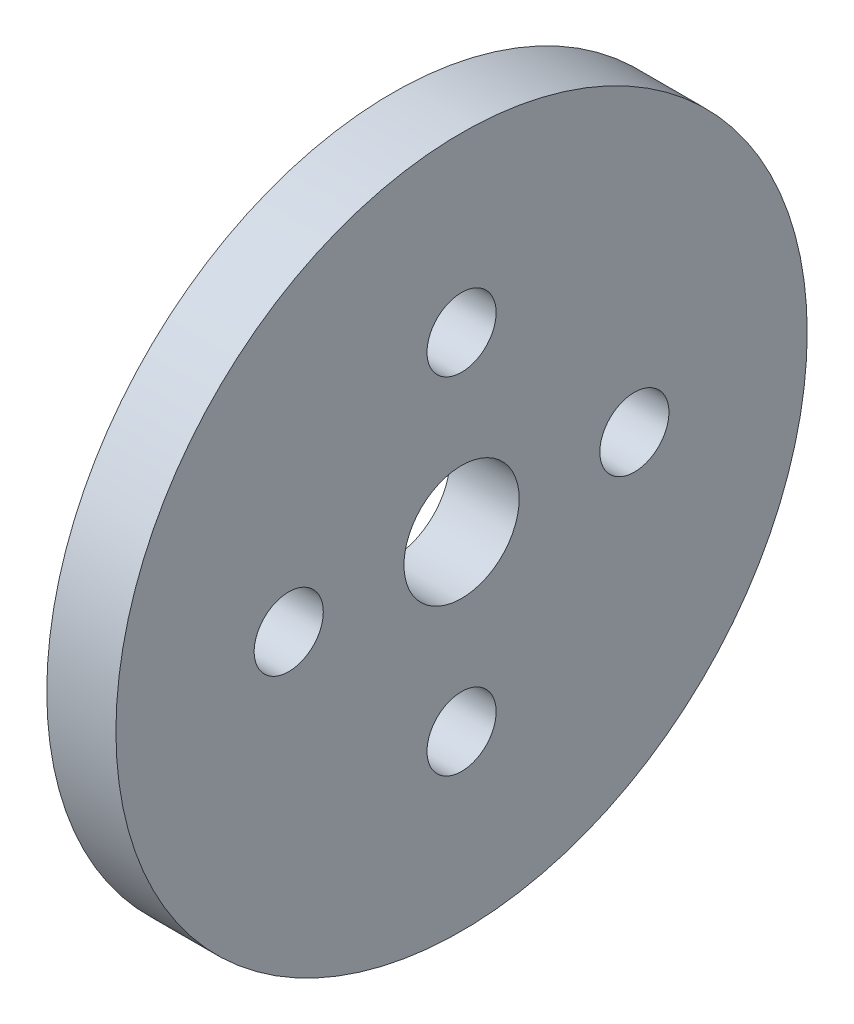
from build123d import *

# Parameters (mm, degrees)
CROQUIS1_R              = 15
CROQUIS1_R_2            = 2.5
CROQUIS1_R_3            = 1.5
SALIENTE_EXTRUIR1_DEPTH = 3


with BuildPart() as part:
    # Croquis1 → Saliente-Extruir1 (new body)
    with BuildSketch(Plane(origin=(0, 0, 0), x_dir=(0, 0, -1), z_dir=(1, 0, 0))):
        Circle(CROQUIS1_R)
        Circle(CROQUIS1_R_2, mode=Mode.SUBTRACT)
        with Locations((0, 7.5)):
            Circle(CROQUIS1_R_3, mode=Mode.SUBTRACT)
        with Locations((7.5, 0)):
            Circle(CROQUIS1_R_3, mode=Mode.SUBTRACT)
        with Locations((0, -7.5)):
            Circle(CROQUIS1_R_3, mode=Mode.SUBTRACT)
        with Locations((-7.5, 0)):
            Circle(CROQUIS1_R_3, mode=Mode.SUBTRACT)
    extrude(amount=SALIENTE_EXTRUIR1_DEPTH)


solid = part.part
